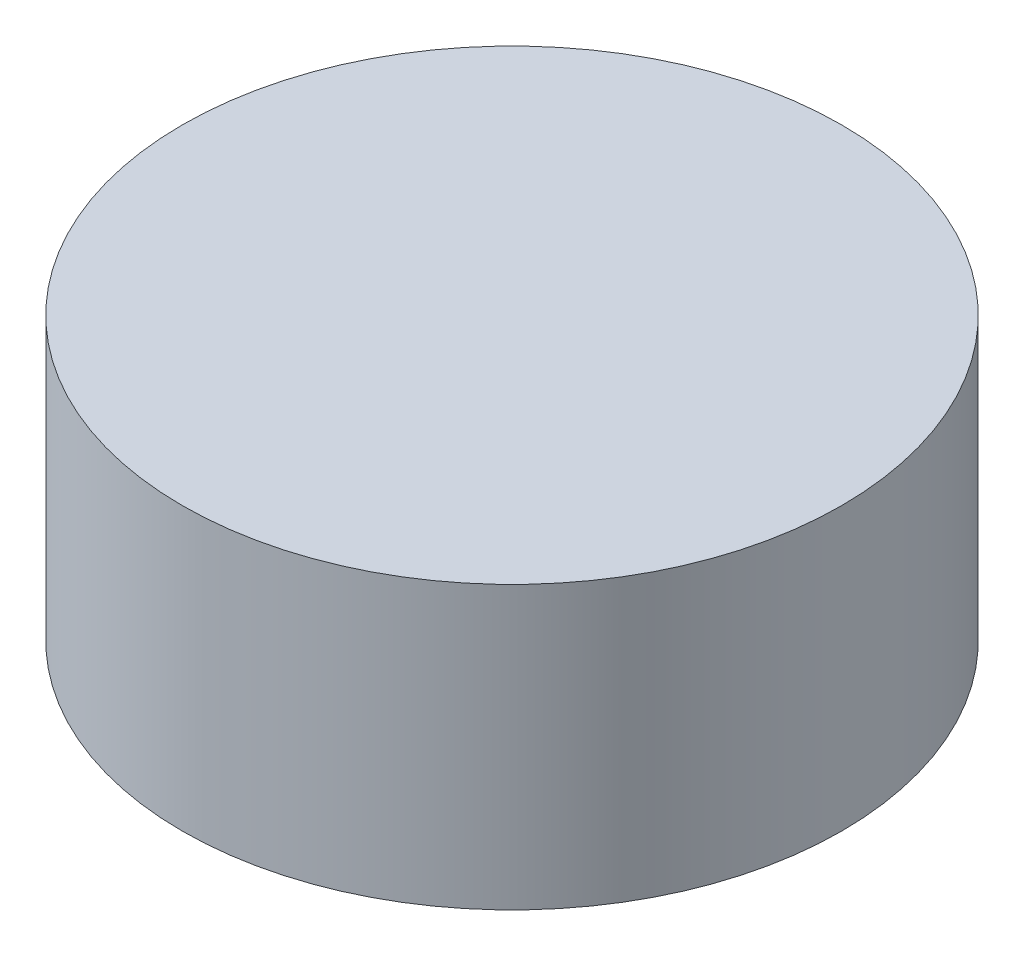
from build123d import *

# Parameters (mm, degrees)
CURVESKETCH_R   = 13.719
CURVEBOSS_DEPTH = 11.731


with BuildPart() as part:
    # CurveSketch → CurveBoss (new body)
    with BuildSketch(Plane(origin=(0, 0, 0), x_dir=(1, 0, 0), z_dir=(0, 1, 0))):
        with Locations(Location((-7.391, 11.173, 0), (0, 0, 270))):
            Circle(CURVESKETCH_R)
    extrude(amount=CURVEBOSS_DEPTH)


solid = part.part
